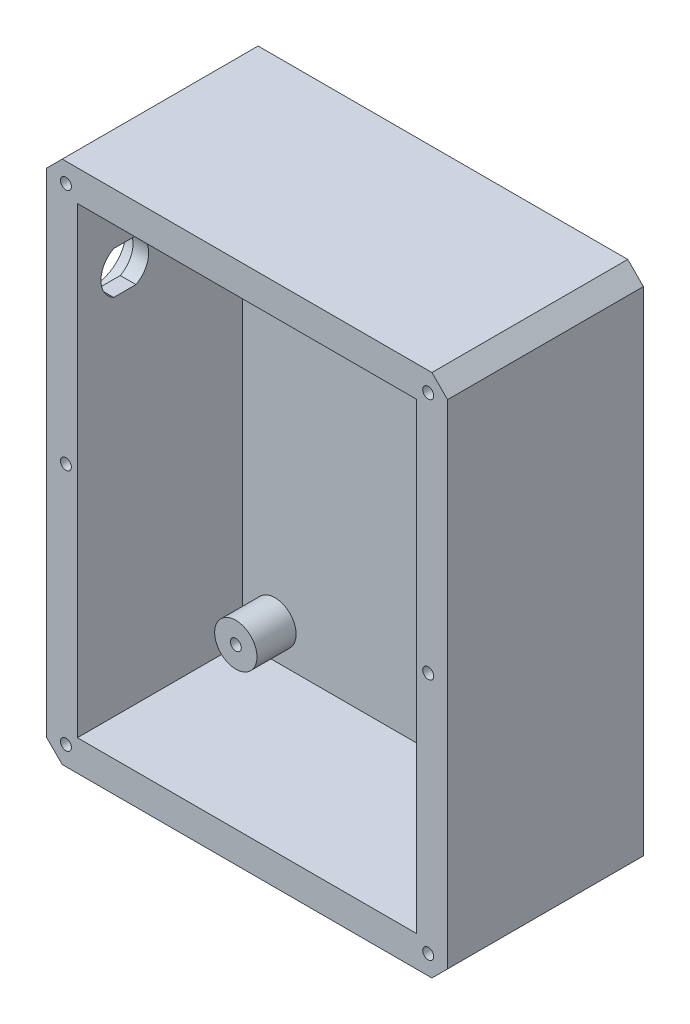
from build123d import *

# Parameters (mm, degrees)
SKETCH1_W           = 55
SKETCH1_H           = 75
SKETCH1_R           = 0.889
BOSS_EXTRUDE1_DEPTH = 5
SKETCH2_W           = 65
SKETCH2_H           = 85
SKETCH2_W_2         = 55
SKETCH2_H_2         = 75
BOSS_EXTRUDE2_DEPTH = 31.75
CUT_EXTRUDE1_REACH  = 85.901
SKETCH4_R           = 5.207
CUT_EXTRUDE2_DEPTH  = 2.46
CHAMFER1_SIZE       = 2.54
SKETCH5_R           = 0.889
CUT_EXTRUDE3_DEPTH  = 19.05
SKETCH6_R           = 3.429
SKETCH6_R_2         = 0.889
BOSS_EXTRUDE3_DEPTH = 6.35


with BuildPart() as part:
    # Sketch1 → Boss-Extrude1 (new body)
    with BuildSketch(Plane.XY):
        Rectangle(SKETCH1_W, SKETCH1_H)
        with Locations((-22.225, 32.004)):
            Circle(SKETCH1_R, mode=Mode.SUBTRACT)
        with Locations(Location((-22.225, -32.004, 0), (0, 0, 180))):
            Circle(SKETCH1_R, mode=Mode.SUBTRACT)
        with Locations((22.225, -32.004)):
            Circle(SKETCH1_R, mode=Mode.SUBTRACT)
        with Locations(Location((22.225, 32.004, 0), (0, 0, 180))):
            Circle(SKETCH1_R, mode=Mode.SUBTRACT)
    extrude(amount=BOSS_EXTRUDE1_DEPTH)

    # Sketch2 → Boss-Extrude2 (add)
    with BuildSketch(Plane(origin=(0, 0, 0), x_dir=(-1, 0, 0), z_dir=(0, 0, -1))):
        Rectangle(SKETCH2_W, SKETCH2_H)
        Rectangle(SKETCH2_W_2, SKETCH2_H_2, mode=Mode.SUBTRACT)
    extrude(amount=-BOSS_EXTRUDE2_DEPTH)

    # Sketch3 → Cut-Extrude1 (cut, up to next)
    with BuildSketch(Plane.ZY.offset(32.5), mode=Mode.PRIVATE) as cut_extrude1_sk1:
        with BuildLine():
            Line((25.868155142, 21.371), (22.264844858, 21.371))
            ThreePointArc((22.264844858, 21.371), (20.193, 24.8), (22.264844858, 28.229))
            Line((22.264844858, 28.229), (25.868155142, 28.229))
            ThreePointArc((25.868155142, 28.229), (27.94, 24.8), (25.868155142, 21.371))
        make_face()
    cut_extrude1_tool1 = extrude(cut_extrude1_sk1.sketch, amount=-CUT_EXTRUDE1_REACH, mode=Mode.PRIVATE) & part.part
    add(cut_extrude1_tool1.solids().sort_by_distance((-32.5, 24.8, 24.0665))[0], mode=Mode.SUBTRACT)

    # Sketch4 → Cut-Extrude2 (cut)
    with BuildSketch(Plane.ZY.offset(32.5)):
        with Locations((24.0665, 24.8)):
            Circle(SKETCH4_R)
    extrude(amount=-CUT_EXTRUDE2_DEPTH, mode=Mode.SUBTRACT)

    # Chamfer1
    chamfer1_edges = [part.edges().sort_by_distance(p)[0] for p in [
        (32.5, 42.5, 15.875),
        (-32.5, 42.5, 15.875),
        (-32.5, -42.5, 15.875),
        (32.5, -42.5, 15.875),
    ]]
    chamfer(chamfer1_edges, length=CHAMFER1_SIZE)

    # Sketch5 → Cut-Extrude3 (cut)
    with BuildSketch(Plane.XY.offset(31.75)):
        with Locations((29.365, 39.365)):
            Circle(SKETCH5_R)
        with Locations((29.365, -39.365)):
            Circle(SKETCH5_R)
        with Locations((-29.365, -39.365)):
            Circle(SKETCH5_R)
        with Locations((-29.365, 39.365)):
            Circle(SKETCH5_R)
        with Locations((29.365, 0)):
            Circle(SKETCH5_R)
        with Locations((-29.365, 0)):
            Circle(SKETCH5_R)
    extrude(amount=-CUT_EXTRUDE3_DEPTH, mode=Mode.SUBTRACT)

    # Sketch6 → Boss-Extrude3 (add)
    # profile 1 of 4: a face of its own
    with BuildSketch(Plane.XY.offset(5)):
        with Locations(Location((-22.225, 32.004, 0), (0, 0, 180))):
            Circle(SKETCH6_R)
        with Locations((-22.225, 32.004)):
            Circle(SKETCH6_R_2, mode=Mode.SUBTRACT)
    # profile 2 of 4: a face of its own
    with BuildSketch(Plane.XY.offset(5)):
        with Locations(Location((-22.225, -32.004, 0), (0, 0, 180))):
            Circle(SKETCH6_R)
        with Locations(Location((-22.225, -32.004, 0), (0, 0, 180))):
            Circle(SKETCH6_R_2, mode=Mode.SUBTRACT)
    # profile 3 of 4: a face of its own
    with BuildSketch(Plane.XY.offset(5)):
        with Locations(Location((22.225, -32.004, 0), (0, 0, 180))):
            Circle(SKETCH6_R)
        with Locations((22.225, -32.004)):
            Circle(SKETCH6_R_2, mode=Mode.SUBTRACT)
    # profile 4 of 4: a face of its own
    with BuildSketch(Plane.XY.offset(5)):
        with Locations(Location((22.225, 32.004, 0), (0, 0, 180))):
            Circle(SKETCH6_R)
        with Locations(Location((22.225, 32.004, 0), (0, 0, 180))):
            Circle(SKETCH6_R_2, mode=Mode.SUBTRACT)
    extrude(amount=BOSS_EXTRUDE3_DEPTH)


solid = part.part
